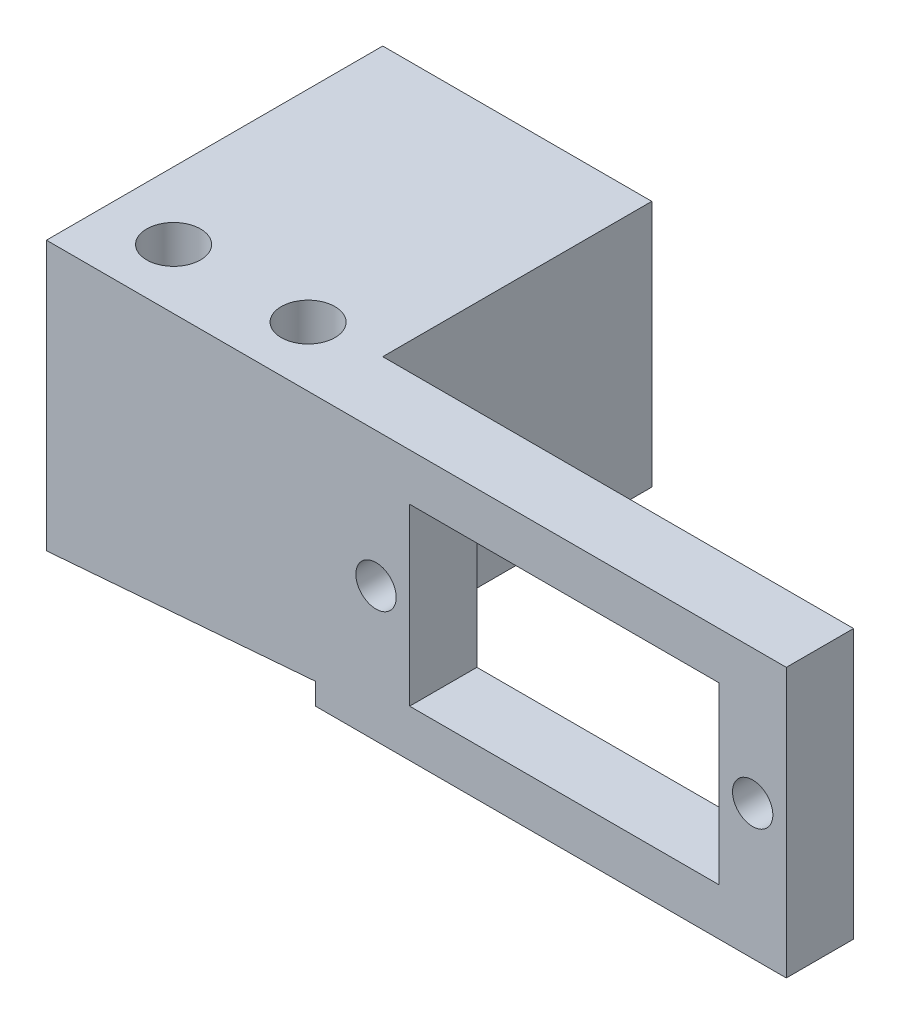
from build123d import *

# Parameters (mm, degrees)
ESQUISSE1_W             = 55
ESQUISSE1_H             = 20
BOSS_EXTRU_1_DEPTH      = 10
ESQUISSE2_R             = 2
ENL_V_MAT_EXTRU_1_DEPTH = 20
ESQUISSE3_R             = 1.5
ESQUISSE3_W             = 23
ESQUISSE3_H             = 13
ENL_V_MAT_EXTRU_2_DEPTH = 20
BOSS_EXTRU_2_DEPTH      = 15
ENL_V_MAT_EXTRU_3_DEPTH = 15
ESQUISSE7_W             = 35
ESQUISSE7_H             = 20
ENL_V_MAT_EXTRU_4_DEPTH = 5


with BuildPart() as part:
    # Esquisse1 → Boss.-Extru.1 (new body)
    with BuildSketch(Plane.XY):
        with Locations((-0.833333333, -1.666666667)):
            Rectangle(ESQUISSE1_W, ESQUISSE1_H)
    extrude(amount=BOSS_EXTRU_1_DEPTH)

    # Esquisse2 → Enlèv. mat.-Extru.1 (cut)
    with BuildSketch(Plane(origin=(0, 8.333333333, 0), x_dir=(1, 0, 0), z_dir=(0, 1, 0))):
        with Locations(Location((-23.333333333, -5.548124667, 0), (0, 0, 270))):
            Circle(ESQUISSE2_R)
        with Locations(Location((-13.333333333, -5.548124667, 0), (0, 0, 270))):
            Circle(ESQUISSE2_R)
    extrude(amount=-ENL_V_MAT_EXTRU_1_DEPTH, mode=Mode.SUBTRACT)

    # Esquisse3 → Enlèv. mat.-Extru.2 (cut)
    with BuildSketch(Plane.XY.offset(10)):
        with Locations((24.166666667, -1.666666667)):
            Circle(ESQUISSE3_R)
        with Locations((-3.833333333, -1.666666667)):
            Circle(ESQUISSE3_R)
        with Locations((10.166666667, -1.666666667)):
            Rectangle(ESQUISSE3_W, ESQUISSE3_H)
    extrude(amount=-ENL_V_MAT_EXTRU_2_DEPTH, mode=Mode.SUBTRACT)

    # Esquisse5 → Boss.-Extru.2 (add)
    with BuildSketch(Plane(origin=(0, 0, 0), x_dir=(-1, 0, 0), z_dir=(0, 0, -1))):
        Polygon((28.333333333, -11.666666667), (28.333333333, 8.333333333), (8.333333333, 8.333333333), (8.333333333, -10.066666667), align=None)
    extrude(amount=BOSS_EXTRU_2_DEPTH)

    # Esquisse6 → Enlèv. mat.-Extru.3 (cut)
    with BuildSketch(Plane(origin=(0, 0, 0), x_dir=(-1, 0, 0), z_dir=(0, 0, -1))):
        Polygon((8.333333333, -10.066666667), (8.333333333, -11.666666667), (28.333333333, -11.666666667), align=None)
    extrude(amount=-ENL_V_MAT_EXTRU_3_DEPTH, mode=Mode.SUBTRACT)

    # Esquisse7 → Enlèv. mat.-Extru.4 (cut)
    with BuildSketch(Plane(origin=(0, 0, 0), x_dir=(-1, 0, 0), z_dir=(0, 0, -1))):
        with Locations((-9.166666667, -1.666666667)):
            Rectangle(ESQUISSE7_W, ESQUISSE7_H)
    extrude(amount=-ENL_V_MAT_EXTRU_4_DEPTH, mode=Mode.SUBTRACT)


solid = part.part
